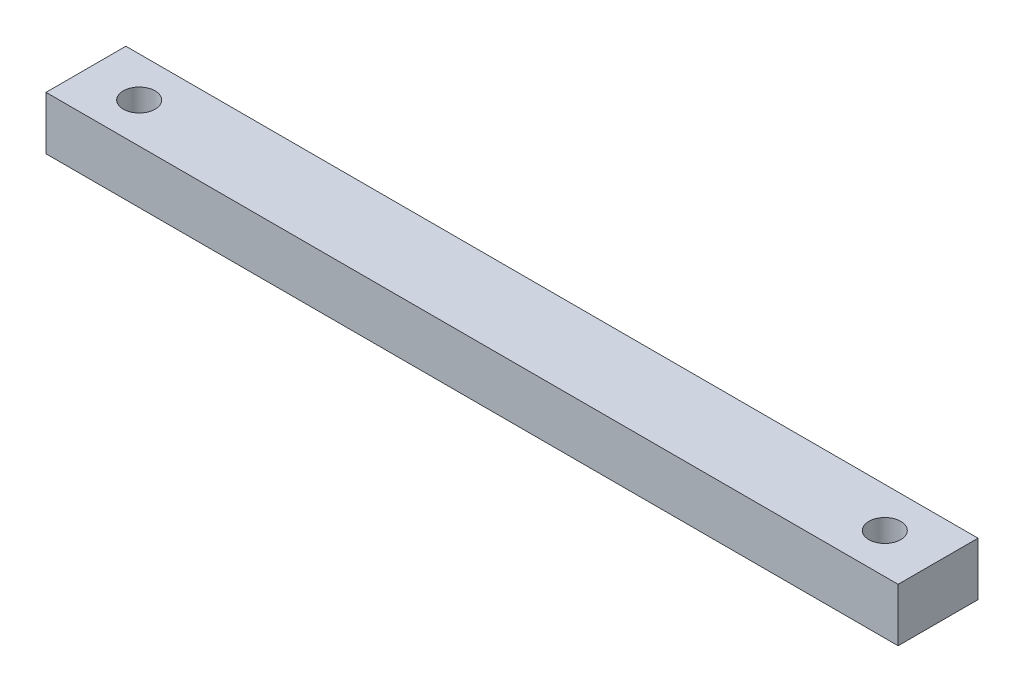
from build123d import *

# Parameters (mm, degrees)
SKETCH1_W             = 101.6
SKETCH1_H             = 9.525
BOSS_EXTRUDE1_DEPTH   = 6.35
F_6_CLEARANCE_HOLE1_D = 3.7973


with BuildPart() as part:
    # Sketch1 → Boss-Extrude1 (new body)
    with BuildSketch(Plane(origin=(0, 0, 0), x_dir=(1, 0, 0), z_dir=(0, 1, 0))):
        Rectangle(SKETCH1_W, SKETCH1_H)
    extrude(amount=BOSS_EXTRUDE1_DEPTH)

    # #6 Clearance Hole1 (through all)
    with Locations(Plane(origin=(-44.45, 6.35, 0), x_dir=(0, 0, 1), z_dir=(0, 1, 0))):
        with Locations((0, 0), (0, 88.9)):
            Hole(F_6_CLEARANCE_HOLE1_D / 2)


solid = part.part
